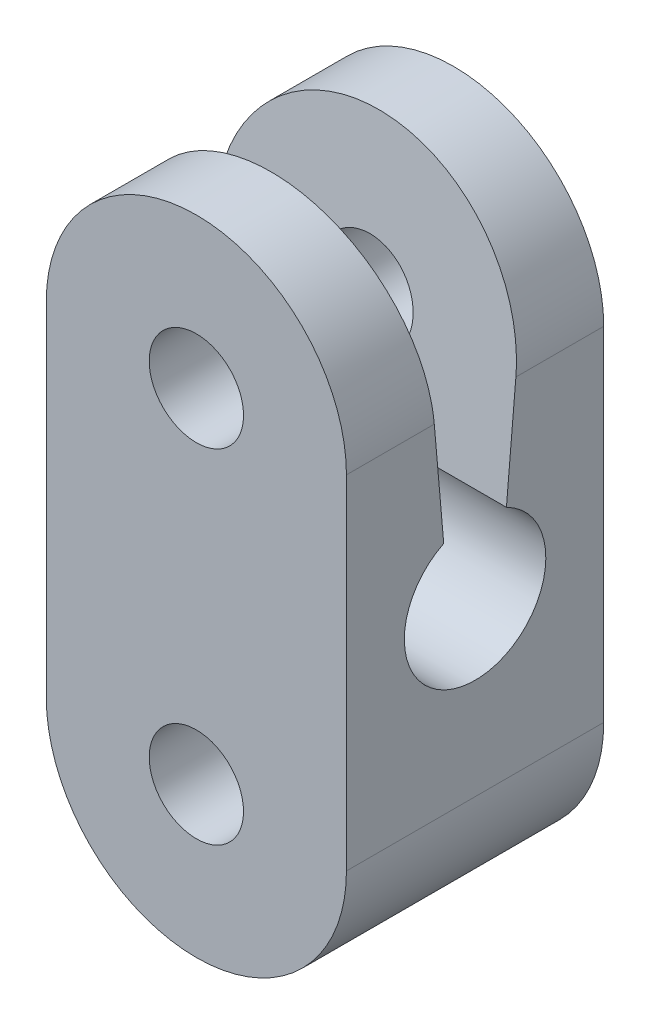
from build123d import *

# Parameters (mm, degrees)
EXTRUDE_1_DEPTH     = 3
SKETCH_2_R          = 1.65
CUT_EXTRUDE_2_DEPTH = 23
SKETCH_3_R          = 1.1
CUT_EXTRUDE_3_DEPTH = 23
SKETCH_4_R          = 1.1
CUT_EXTRUDE_4_DEPTH = 23


with BuildPart() as part:
    # 草图1 → 凸台-拉伸1 (new, symmetric)
    with BuildSketch(Plane.XY):
        with BuildLine():
            Line((-3.5, -4), (-3.5, 4))
            ThreePointArc((-3.5, 4), (0, 7.5), (3.5, 4))
            Line((3.5, 4), (3.5, -4))
            ThreePointArc((3.5, -4), (0, -7.5), (-3.5, -4))
        make_face()
    extrude(amount=EXTRUDE_1_DEPTH, both=True)

    # 草图2 → 切除-拉伸2 (cut)
    with BuildSketch(Plane(origin=(3.5, 0, 0), x_dir=(0, 0, -1), z_dir=(1, 0, 0))):
        Circle(SKETCH_2_R)
        Polygon((-0.730979877, 1.479245895), (-1.405289173, 9.186636415), (1.405289173, 9.186636415), (0.730979877, 1.479245895), (0, 1.479245895), align=None)
    extrude(amount=-CUT_EXTRUDE_2_DEPTH, mode=Mode.SUBTRACT)

    # 草图3 → 切除-拉伸3 (cut)
    with BuildSketch(Plane.XY.offset(3)):
        with Locations((0, 4)):
            Circle(SKETCH_3_R)
    extrude(amount=-CUT_EXTRUDE_3_DEPTH, mode=Mode.SUBTRACT)

    # 草图4 → 切除-拉伸4 (cut)
    with BuildSketch(Plane.XY.offset(3)):
        with Locations((0, -4)):
            Circle(SKETCH_4_R)
    extrude(amount=-CUT_EXTRUDE_4_DEPTH, mode=Mode.SUBTRACT)


solid = part.part
